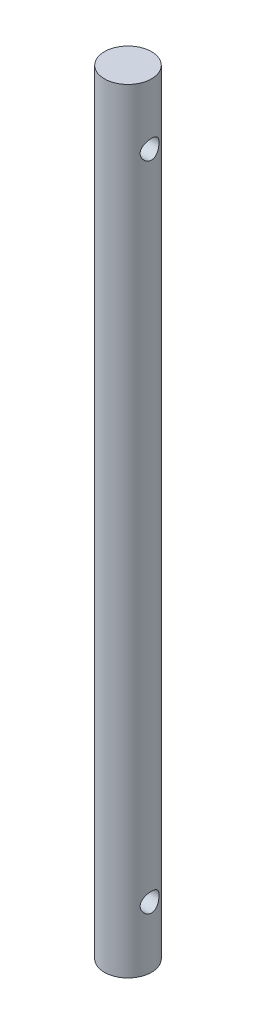
from build123d import *

# Parameters (mm, degrees)
SKETCH1_R           = 3.9624
BOSS_EXTRUDE1_DEPTH = 65.0875
SKETCH2_W           = 18.082766929
SKETCH2_H           = 1.5875


with BuildPart() as part:
    # Sketch1 → Boss-Extrude1 (new, symmetric)
    with BuildSketch(Plane(origin=(0, 0, 0), x_dir=(1, 0, 0), z_dir=(0, 1, 0))):
        with Locations(Location((0, 0, 0), (0, 0, 270))):
            Circle(SKETCH1_R)
    extrude(amount=BOSS_EXTRUDE1_DEPTH, both=True)

    # Sketch2 → Cut-Revolve2 (revolve, cut)
    with BuildSketch(Plane.XY):
        with Locations((-0.527979435, 55.63235)):
            Rectangle(SKETCH2_W, SKETCH2_H)
    cut_revolve2 = revolve(axis=Axis((8.513404029, 54.8386, 0), (-1, 0, 0)), mode=Mode.SUBTRACT)

    # Mirror1: Cut-Revolve2 across plane
    add(cut_revolve2.mirror(Plane.ZX), mode=Mode.SUBTRACT)


solid = part.part
